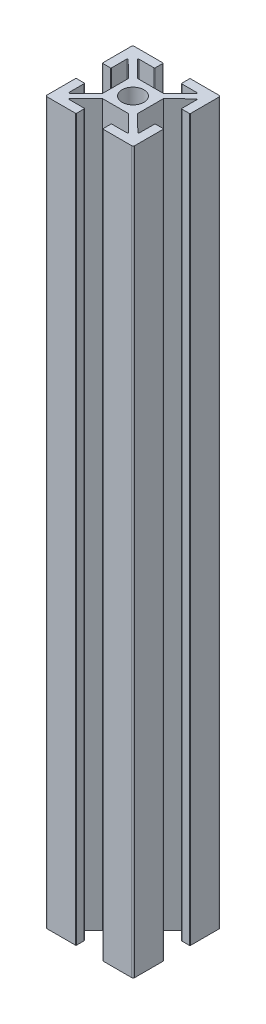
from build123d import *

# Parameters (mm, degrees)
SKETCH1_R           = 2.5
BOSS_EXTRUDE2_DEPTH = 165


with BuildPart() as part:
    # Sketch1 → Boss-Extrude2 (new body)
    with BuildSketch(Plane(origin=(0, 0, 0), x_dir=(1, 0, 0), z_dir=(0, 1, 0))):
        with BuildLine():
            Line((-9.896296296, 3), (-8.196296296, 3))
            ThreePointArc((-8.196296296, 3), (-8.090230279, 3.043933983), (-8.046296296, 3.15))
            Line((-8.046296296, 3.15), (-8.046296296, 6.586184513))
            ThreePointArc((-8.046296296, 6.586184513), (-7.954097251, 6.724600732), (-7.790842301, 6.692859041))
            Line((-7.790842301, 6.692859041), (-4, 2.945390222))
            Line((-4, 2.945390222), (-4, -2.945390222))
            Line((-4, -2.945390222), (-7.790842301, -6.692859041))
            ThreePointArc((-7.790842301, -6.692859041), (-7.954097251, -6.724600732), (-8.046296296, -6.586184513))
            Line((-8.046296296, -6.586184513), (-8.046296296, -3.15))
            ThreePointArc((-8.046296296, -3.15), (-8.090230279, -3.043933983), (-8.196296296, -3))
            Line((-8.196296296, -3), (-9.896296296, -3))
            ThreePointArc((-9.896296296, -3), (-10.002362313, -3.043933983), (-10.046296296, -3.15))
            Line((-10.046296296, -3.15), (-10.046296296, -9.65))
            ThreePointArc((-10.046296296, -9.65), (-9.94378367, -9.897487373), (-9.696296296, -10))
            Line((-9.696296296, -10), (-3.196296296, -10))
            ThreePointArc((-3.196296296, -10), (-3.090230279, -9.956066017), (-3.046296296, -9.85))
            Line((-3.046296296, -9.85), (-3.046296296, -8.15))
            ThreePointArc((-3.046296296, -8.15), (-3.090230279, -8.043933983), (-3.196296296, -8))
            Line((-3.196296296, -8), (-6.614381093, -8))
            ThreePointArc((-6.614381093, -8), (-6.753127587, -7.9070036), (-6.719835089, -7.743325472))
            Line((-6.719835089, -7.743325472), (-2.93318409, -4))
            Line((-2.93318409, -4), (2.93318409, -4))
            Line((2.93318409, -4), (6.719835089, -7.743325472))
            ThreePointArc((6.719835089, -7.743325472), (6.753127587, -7.9070036), (6.614381093, -8))
            Line((6.614381093, -8), (3.196296296, -8))
            ThreePointArc((3.196296296, -8), (3.090230279, -8.043933983), (3.046296296, -8.15))
            Line((3.046296296, -8.15), (3.046296296, -9.85))
            ThreePointArc((3.046296296, -9.85), (3.090230279, -9.956066017), (3.196296296, -10))
            Line((3.196296296, -10), (9.696296296, -10))
            ThreePointArc((9.696296296, -10), (9.94378367, -9.897487373), (10.046296296, -9.65))
            Line((10.046296296, -9.65), (10.046296296, -3.15))
            ThreePointArc((10.046296296, -3.15), (10.002362313, -3.043933983), (9.896296296, -3))
            Line((9.896296296, -3), (8.196296296, -3))
            ThreePointArc((8.196296296, -3), (8.090230279, -3.043933983), (8.046296296, -3.15))
            Line((8.046296296, -3.15), (8.046296296, -6.586184513))
            ThreePointArc((8.046296296, -6.586184513), (7.954097251, -6.724600732), (7.790842301, -6.692859041))
            Line((7.790842301, -6.692859041), (4, -2.945390222))
            Line((4, -2.945390222), (4, 2.945390222))
            Line((4, 2.945390222), (7.790842301, 6.692859041))
            ThreePointArc((7.790842301, 6.692859041), (7.954097251, 6.724600732), (8.046296296, 6.586184513))
            Line((8.046296296, 6.586184513), (8.046296296, 3.15))
            ThreePointArc((8.046296296, 3.15), (8.090230279, 3.043933983), (8.196296296, 3))
            Line((8.196296296, 3), (9.896296296, 3))
            ThreePointArc((9.896296296, 3), (10.002362313, 3.043933983), (10.046296296, 3.15))
            Line((10.046296296, 3.15), (10.046296296, 9.65))
            ThreePointArc((10.046296296, 9.65), (9.94378367, 9.897487373), (9.696296296, 10))
            Line((9.696296296, 10), (3.196296296, 10))
            ThreePointArc((3.196296296, 10), (3.090230279, 9.956066017), (3.046296296, 9.85))
            Line((3.046296296, 9.85), (3.046296296, 8.15))
            ThreePointArc((3.046296296, 8.15), (3.090230279, 8.043933983), (3.196296296, 8))
            Line((3.196296296, 8), (6.614381093, 8))
            ThreePointArc((6.614381093, 8), (6.753127587, 7.9070036), (6.719835089, 7.743325472))
            Line((6.719835089, 7.743325472), (2.93318409, 4))
            Line((2.93318409, 4), (-2.93318409, 4))
            Line((-2.93318409, 4), (-6.719835089, 7.743325472))
            ThreePointArc((-6.719835089, 7.743325472), (-6.753127587, 7.9070036), (-6.614381093, 8))
            Line((-6.614381093, 8), (-3.196296296, 8))
            ThreePointArc((-3.196296296, 8), (-3.090230279, 8.043933983), (-3.046296296, 8.15))
            Line((-3.046296296, 8.15), (-3.046296296, 9.85))
            ThreePointArc((-3.046296296, 9.85), (-3.090230279, 9.956066017), (-3.196296296, 10))
            Line((-3.196296296, 10), (-9.696296296, 10))
            ThreePointArc((-9.696296296, 10), (-9.94378367, 9.897487373), (-10.046296296, 9.65))
            Line((-10.046296296, 9.65), (-10.046296296, 3.15))
            ThreePointArc((-10.046296296, 3.15), (-10.002362313, 3.043933983), (-9.896296296, 3))
        make_face()
        with Locations(Location((0, 0, 0), (0, 0, 270))):
            Circle(SKETCH1_R, mode=Mode.SUBTRACT)
    extrude(amount=BOSS_EXTRUDE2_DEPTH)


solid = part.part
